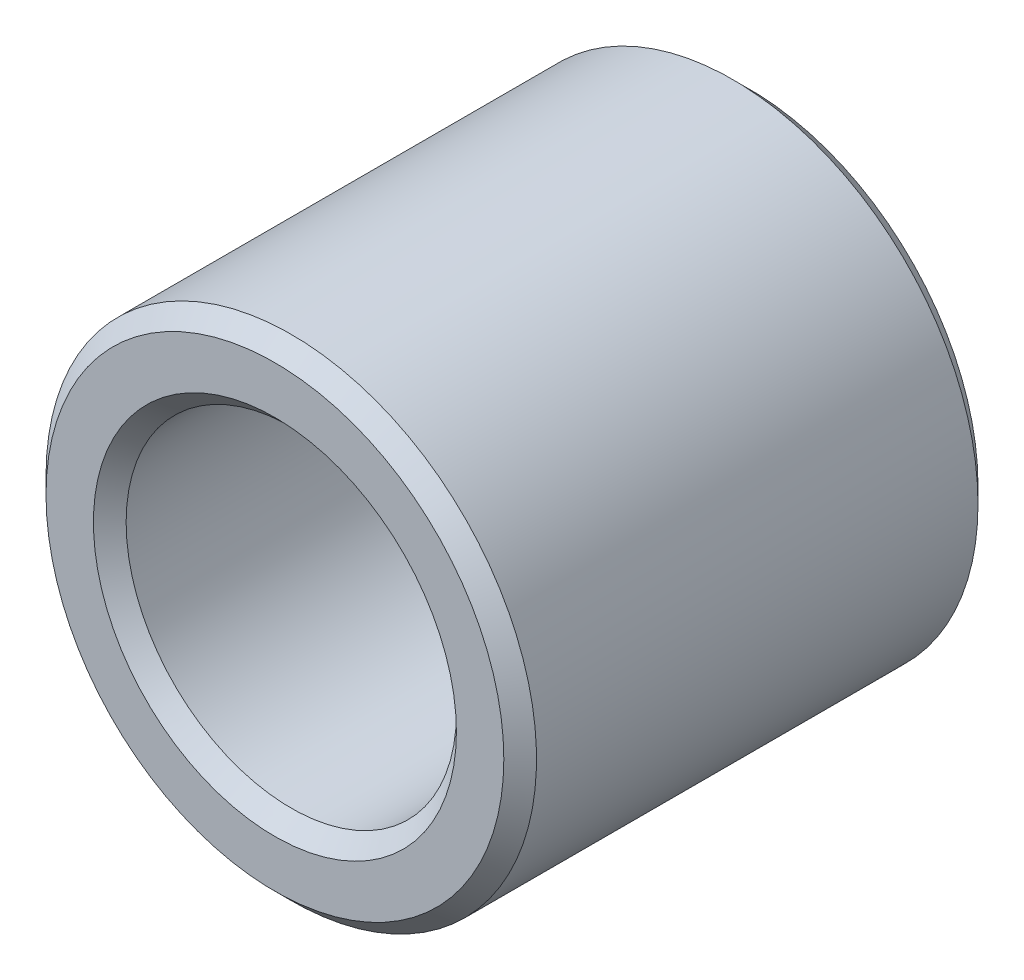
from build123d import *

# Parameters (mm, degrees)
ESBO_O1_R                = 7.5
ESBO_O1_R_2              = 5.05
RESSALTO_EXTRUS_O1_DEPTH = 7.25
CHANFRO1_SIZE            = 0.5


with BuildPart() as part:
    # Esboço1 → Ressalto-extrusão1 (new, symmetric)
    with BuildSketch(Plane.XY):
        with Locations(Location((0, 0, 0), (0, 0, 180))):
            Circle(ESBO_O1_R)
        with Locations(Location((0, 0, 0), (0, 0, 180))):
            Circle(ESBO_O1_R_2, mode=Mode.SUBTRACT)
    extrude(amount=RESSALTO_EXTRUS_O1_DEPTH, both=True)

    # Chanfro1
    chanfro1_edges = [part.edges().sort_by_distance(p)[0] for p in [
        (7.5, 0, -7.25),
        (7.5, 0, 7.25),
        (5.05, 0, -7.25),
        (5.05, 0, 7.25),
    ]]
    chamfer(chanfro1_edges, length=CHANFRO1_SIZE)


solid = part.part
